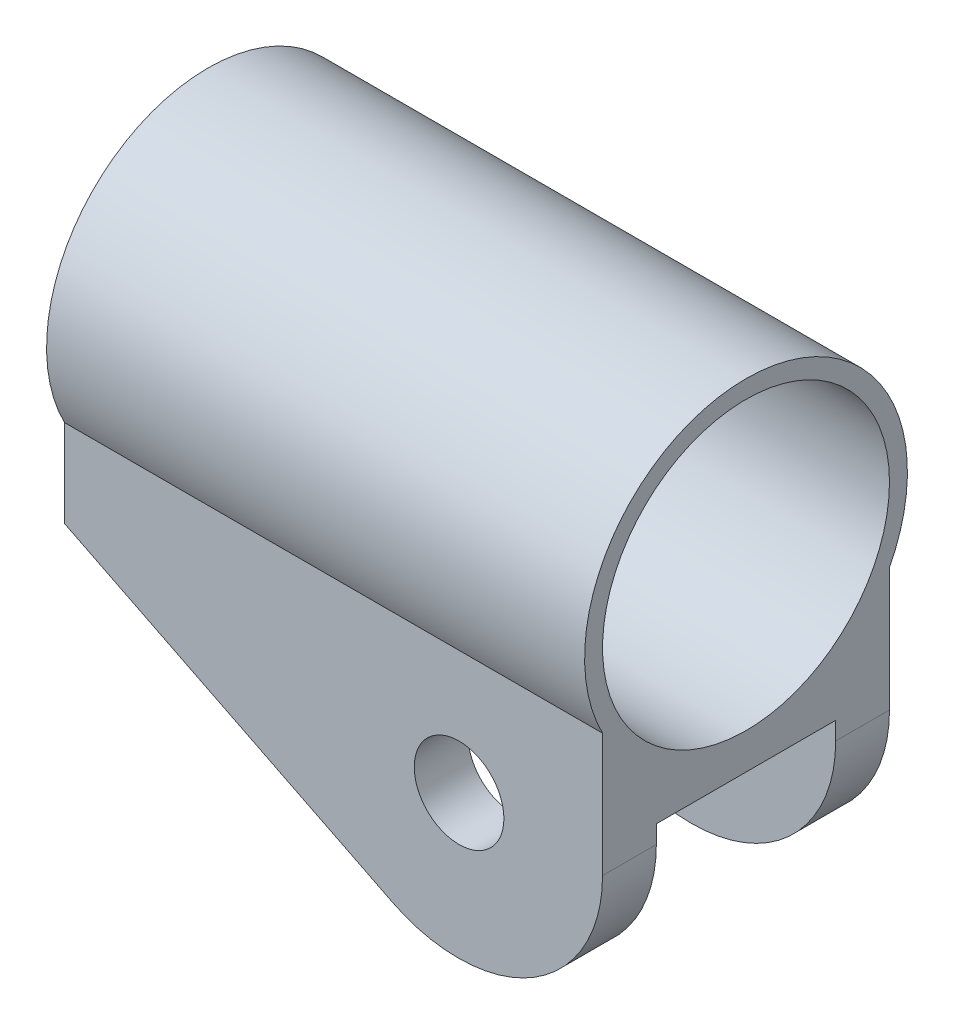
from build123d import *

# Parameters (mm, degrees)
SKETCH1_R                       = 9
SKETCH1_R_2                     = 8
BOSS_EXTRUDE1_DEPTH             = 30
SKETCH2_W                       = 30
SKETCH2_H                       = 16
BOSS_EXTRUDE2_DEPTH             = 10
BOSS_EXTRUDE2_DIRECTION_2_REACH = 38.125
CUT_EXTRUDE1_DEPTH              = 40.37003937
SKETCH4_W                       = 10
SKETCH4_H                       = 9
CUT_EXTRUDE2_DEPTH              = 37.633318168
FILLET1_R                       = 8
SKETCH5_R                       = 2.5
CUT_EXTRUDE3_DEPTH              = 40.37003937


with BuildPart() as part:
    # Sketch1 → Boss-Extrude1 (new body)
    with BuildSketch(Plane(origin=(0, 0, 0), x_dir=(0, 0, -1), z_dir=(1, 0, 0))):
        Circle(SKETCH1_R)
        Circle(SKETCH1_R_2, mode=Mode.SUBTRACT)
    extrude(amount=BOSS_EXTRUDE1_DEPTH)

    # Sketch2 → Boss-Extrude2 (add)
    with BuildSketch(Plane(origin=(0, -9, 0), x_dir=(-1, 0, 0), z_dir=(0, -1, 0))):
        with Locations((-15, 0)):
            Rectangle(SKETCH2_W, SKETCH2_H)
    extrude(amount=BOSS_EXTRUDE2_DEPTH)

    # Sketch2 → Boss-Extrude2 direction 2 (add, up to next)
    with BuildSketch(Plane(origin=(0, -9, 0), x_dir=(-1, 0, 0), z_dir=(0, -1, 0)), mode=Mode.PRIVATE) as boss_extrude2_direction_2_sk1:
        with Locations((-15, 0)):
            Rectangle(SKETCH2_W, SKETCH2_H)
    boss_extrude2_direction_2_tool1 = extrude(boss_extrude2_direction_2_sk1.sketch, amount=-BOSS_EXTRUDE2_DIRECTION_2_REACH, mode=Mode.PRIVATE) - part.part
    add(boss_extrude2_direction_2_tool1.solids().sort_by_distance((15, -9, 0))[0])
    add(boss_extrude2_direction_2_tool1.solids().sort_by_distance((15, -9, 0))[1])

    # Sketch3 → Cut-Extrude1 (cut, through all)
    with BuildSketch(Plane.XY.offset(8)):
        Polygon((0, -19), (0, -9), (20, -19), align=None)
    extrude(amount=-CUT_EXTRUDE1_DEPTH, mode=Mode.SUBTRACT)

    # Sketch4 → Cut-Extrude2 (cut, through all)
    with BuildSketch(Plane(origin=(30, 0, 0), x_dir=(0, 0, -1), z_dir=(1, 0, 0))):
        with Locations((0, -14.5)):
            Rectangle(SKETCH4_W, SKETCH4_H)
    extrude(amount=-CUT_EXTRUDE2_DEPTH, mode=Mode.SUBTRACT)

    # Fillet1
    fillet1_edges = [part.edges().sort_by_distance(p)[0] for p in [
        (30, -19, -6.5),
        (20, -19, -6.5),
        (20, -19, 6.5),
        (30, -19, 6.5),
    ]]
    fillet(fillet1_edges, radius=FILLET1_R)

    # Sketch5 → Cut-Extrude3 (cut, through all)
    with BuildSketch(Plane.XY.offset(8)):
        with Locations((22, -11)):
            Circle(SKETCH5_R)
    extrude(amount=-CUT_EXTRUDE3_DEPTH, mode=Mode.SUBTRACT)


solid = part.part
